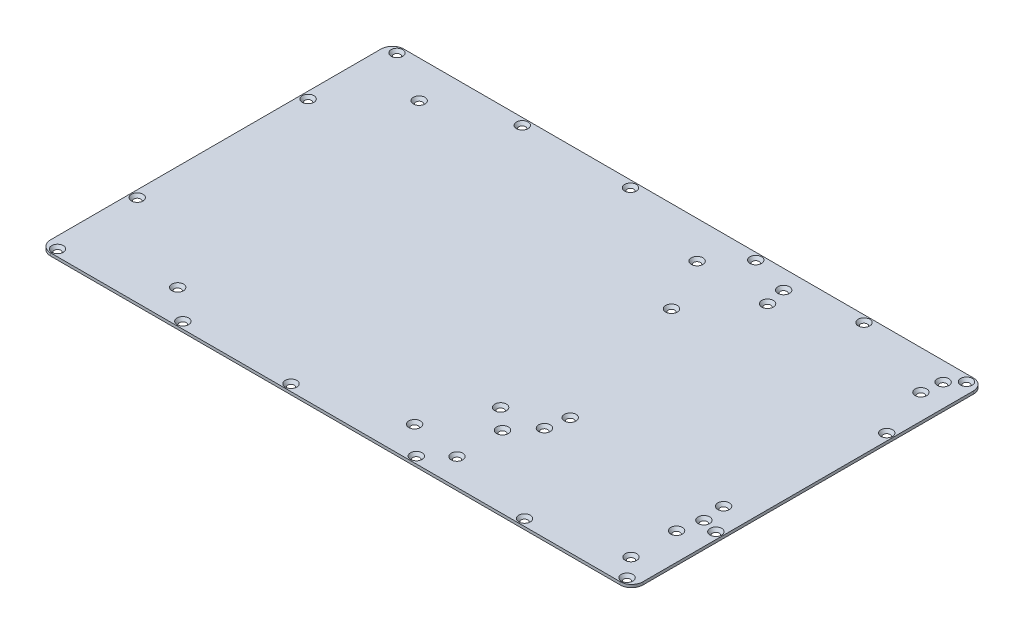
from build123d import *

# Parameters (mm, degrees)
SKETCH1_W                                     = 330.2
SKETCH1_H                                     = 196.85
BOSS_EXTRUDE1_DEPTH                           = 1.5875
FILLET1_R                                     = 6.35
CSK_FOR_4_FLAT_HEAD_SOCKET_CAP_SCREW1_A_COUNT = 2
CSK_FOR_4_FLAT_HEAD_SOCKET_CAP_SCREW1_A_PITCH = 95.25
LPATTERN1_COUNT                               = 2
LPATTERN1_PITCH                               = 120.015
CSK_FOR_4_FLAT_HEAD_SOCKET_CAP_SCREW2_A_COUNT = 2
CSK_FOR_4_FLAT_HEAD_SOCKET_CAP_SCREW2_A_PITCH = 57.15
CSK_FOR_4_FLAT_HEAD_SOCKET_CAP_SCRE_2_COUNT   = 2
CSK_FOR_4_FLAT_HEAD_SOCKET_CAP_SCRE_2_PITCH   = 117.475
CSK_FOR_4_FLAT_HEAD_SOCKET_CAP_SCRE_3_COUNT   = 2
CSK_FOR_4_FLAT_HEAD_SOCKET_CAP_SCRE_3_PITCH   = 187.325
CSK_FOR_4_FLAT_HEAD_SOCKET_CAP_SCRE_4_COUNT   = 2
CSK_FOR_4_FLAT_HEAD_SOCKET_CAP_SCRE_4_PITCH   = 247.65
CSK_FOR_4_FLAT_HEAD_SOCKET_CAP_SCRE_5_COUNT   = 2
CSK_FOR_4_FLAT_HEAD_SOCKET_CAP_SCRE_5_PITCH   = 317.5
CSK_FOR_4_FLAT_HEAD_SOCKET_CAP_SCREW3_A_COUNT = 2
CSK_FOR_4_FLAT_HEAD_SOCKET_CAP_SCREW3_A_PITCH = 88.9
CSK_FOR_4_FLAT_HEAD_SOCKET_CAP_SCRE_6_COUNT   = 2
CSK_FOR_4_FLAT_HEAD_SOCKET_CAP_SCRE_6_PITCH   = 160.266754194
CSK_FOR_4_FLAT_HEAD_SOCKET_CAP_SCRE_7_COUNT   = 2
CSK_FOR_4_FLAT_HEAD_SOCKET_CAP_SCRE_7_PITCH   = 133.35
CSK_FOR_4_FLAT_HEAD_SOCKET_CAP_SCREW4_A_COUNT = 2
CSK_FOR_4_FLAT_HEAD_SOCKET_CAP_SCREW4_A_PITCH = 85.4964
CSK_FOR_4_FLAT_HEAD_SOCKET_CAP_SCRE_8_COUNT   = 2
CSK_FOR_4_FLAT_HEAD_SOCKET_CAP_SCRE_8_PITCH   = 110.0074
CSK_FOR_4_FLAT_HEAD_SOCKET_CAP_SCRE_9_COUNT   = 2
CSK_FOR_4_FLAT_HEAD_SOCKET_CAP_SCRE_9_PITCH   = 139.324306809
CSK_FOR_4_FLAT_HEAD_SOCKET_CAP_SCREW5_A_COUNT = 2
CSK_FOR_4_FLAT_HEAD_SOCKET_CAP_SCREW5_A_PITCH = 25.4
CSK_FOR_4_FLAT_HEAD_SOCKET_CAP_SCRE_10_COUNT  = 2
CSK_FOR_4_FLAT_HEAD_SOCKET_CAP_SCRE_10_PITCH  = 97.028
CSK_FOR_4_FLAT_HEAD_SOCKET_CAP_SCRE_11_COUNT  = 2
CSK_FOR_4_FLAT_HEAD_SOCKET_CAP_SCRE_11_PITCH  = 100.297521325
CSK_FOR_4_FLAT_HEAD_SOCKET_CAP_SCREW6_A_COUNT = 2
CSK_FOR_4_FLAT_HEAD_SOCKET_CAP_SCREW6_A_PITCH = 154.94
CSK_FOR_4_FLAT_HEAD_SOCKET_CAP_SCRE_12_COUNT  = 2
CSK_FOR_4_FLAT_HEAD_SOCKET_CAP_SCRE_12_PITCH  = 220.921601479
CSK_FOR_4_FLAT_HEAD_SOCKET_CAP_SCRE_13_COUNT  = 2
CSK_FOR_4_FLAT_HEAD_SOCKET_CAP_SCRE_13_PITCH  = 159.130543894


with BuildPart() as part:
    # Sketch1 → Boss-Extrude1 (new body)
    with BuildSketch(Plane(origin=(0, 0, 0), x_dir=(1, 0, 0), z_dir=(0, 1, 0))):
        Rectangle(SKETCH1_W, SKETCH1_H)
    extrude(amount=BOSS_EXTRUDE1_DEPTH)

    # Fillet1
    fillet1_edges = [part.edges().sort_by_distance(p)[0] for p in [
        (165.1, 0.79375, 98.425),
        (-165.1, 0.79375, 98.425),
        (-165.1, 0.79375, -98.425),
        (165.1, 0.79375, -98.425),
    ]]
    fillet(fillet1_edges, radius=FILLET1_R)

    # Sketch2 → CSK for #4 Flat Head Socket Cap Screw1 (revolve, cut)
    with BuildSketch(Plane(origin=(161.29, 1.5875, 47.625), x_dir=(0, 0, 1), z_dir=(1, 0, 0))):
        Polygon((0, 0), (0, 1.5875), (1.63195, 1.5875), (1.63195, 1.848124365), (3.2385, 0), align=None)
    csk_for_4_flat_head_socket_cap_screw1 = revolve(axis=Axis((161.29, 7.9375, 47.625), (0, -1, 0)), mode=Mode.SUBTRACT)

    # CSK for #4 Flat Head Socket Cap Screw1 a: CSK for #4 Flat Head Socket Cap Screw1 ×2
    with Locations(*[(0, 0, -i * CSK_FOR_4_FLAT_HEAD_SOCKET_CAP_SCREW1_A_PITCH) for i in range(1, CSK_FOR_4_FLAT_HEAD_SOCKET_CAP_SCREW1_A_COUNT)]):
        add(csk_for_4_flat_head_socket_cap_screw1, mode=Mode.SUBTRACT)

    # LPattern1: CSK for #4 Flat Head Socket Cap Screw1 ×2
    with Locations(*[(-i * LPATTERN1_PITCH, 0, 0) for i in range(1, LPATTERN1_COUNT)]):
        add(csk_for_4_flat_head_socket_cap_screw1, mode=Mode.SUBTRACT)

    # LPattern1 copy 1 sketch → LPattern1 copy 1 (revolve, cut)
    with BuildSketch(Plane(origin=(41.275, 1.5875, -47.625), x_dir=(0, 0, 1), z_dir=(1, 0, 0))):
        Polygon((0, 0), (0, 1.5875), (1.63195, 1.5875), (1.63195, 1.848124365), (3.2385, 0), align=None)
    revolve(axis=Axis((41.275, 7.9375, -47.625), (0, -1, 0)), mode=Mode.SUBTRACT)

    # Mirror1: CSK for #4 Flat Head Socket Cap Screw1 across plane
    add(csk_for_4_flat_head_socket_cap_screw1.mirror(Plane(origin=(0, 0, 0), x_dir=(0, 0, 1), z_dir=(1, 0, 0))), mode=Mode.SUBTRACT)

    # Mirror1 copy 1 sketch → Mirror1 copy 1 (revolve, cut)
    with BuildSketch(Plane(origin=(-161.29, 1.5875, -47.625), x_dir=(0, 0, 1), z_dir=(-1, 0, 0))):
        Polygon((0, 0), (0, -1.5875), (1.63195, -1.5875), (1.63195, -1.848124365), (3.2385, 0), align=None)
    revolve(axis=Axis((-161.29, 7.9375, -47.625), (0, 1, 0)), mode=Mode.SUBTRACT)

    # Sketch7 → CSK for #4 Flat Head Socket Cap Screw2 (revolve, cut)
    with BuildSketch(Plane(origin=(158.75, 1.5875, 94.615), x_dir=(0, 0, 1), z_dir=(1, 0, 0))):
        Polygon((0, 0), (0, 1.5875), (1.63195, 1.5875), (1.63195, 1.848124365), (3.2385, 0), align=None)
    csk_for_4_flat_head_socket_cap_screw2 = revolve(axis=Axis((158.75, 7.9375, 94.615), (0, -1, 0)), mode=Mode.SUBTRACT)

    # CSK for #4 Flat Head Socket Cap Screw2 a: CSK for #4 Flat Head Socket Cap Screw2 ×2
    with Locations(*[(-i * CSK_FOR_4_FLAT_HEAD_SOCKET_CAP_SCREW2_A_PITCH, 0, 0) for i in range(1, CSK_FOR_4_FLAT_HEAD_SOCKET_CAP_SCREW2_A_COUNT)]):
        add(csk_for_4_flat_head_socket_cap_screw2, mode=Mode.SUBTRACT)

    # CSK for _4 Flat Head Socket Cap Scre 2: CSK for #4 Flat Head Socket Cap Screw2 ×2
    with Locations(*[(-i * CSK_FOR_4_FLAT_HEAD_SOCKET_CAP_SCRE_2_PITCH, 0, 0) for i in range(1, CSK_FOR_4_FLAT_HEAD_SOCKET_CAP_SCRE_2_COUNT)]):
        add(csk_for_4_flat_head_socket_cap_screw2, mode=Mode.SUBTRACT)

    # CSK for _4 Flat Head Socket Cap Scre 3: CSK for #4 Flat Head Socket Cap Screw2 ×2
    with Locations(*[(-i * CSK_FOR_4_FLAT_HEAD_SOCKET_CAP_SCRE_3_PITCH, 0, 0) for i in range(1, CSK_FOR_4_FLAT_HEAD_SOCKET_CAP_SCRE_3_COUNT)]):
        add(csk_for_4_flat_head_socket_cap_screw2, mode=Mode.SUBTRACT)

    # CSK for _4 Flat Head Socket Cap Scre 4: CSK for #4 Flat Head Socket Cap Screw2 ×2
    with Locations(*[(-i * CSK_FOR_4_FLAT_HEAD_SOCKET_CAP_SCRE_4_PITCH, 0, 0) for i in range(1, CSK_FOR_4_FLAT_HEAD_SOCKET_CAP_SCRE_4_COUNT)]):
        add(csk_for_4_flat_head_socket_cap_screw2, mode=Mode.SUBTRACT)

    # CSK for _4 Flat Head Socket Cap Scre 5: CSK for #4 Flat Head Socket Cap Screw2 ×2
    with Locations(*[(-i * CSK_FOR_4_FLAT_HEAD_SOCKET_CAP_SCRE_5_PITCH, 0, 0) for i in range(1, CSK_FOR_4_FLAT_HEAD_SOCKET_CAP_SCRE_5_COUNT)]):
        add(csk_for_4_flat_head_socket_cap_screw2, mode=Mode.SUBTRACT)

    # Mirror2: CSK for #4 Flat Head Socket Cap Screw2 across plane
    add(csk_for_4_flat_head_socket_cap_screw2.mirror(Plane.XY), mode=Mode.SUBTRACT)

    # Mirror2 copy 1 sketch → Mirror2 copy 1 (revolve, cut)
    with BuildSketch(Plane(origin=(101.6, 1.5875, -94.615), x_dir=(0, 0, -1), z_dir=(1, 0, 0))):
        Polygon((0, 0), (0, -1.5875), (1.63195, -1.5875), (1.63195, -1.848124365), (3.2385, 0), align=None)
    revolve(axis=Axis((101.6, 7.9375, -94.615), (0, 1, 0)), mode=Mode.SUBTRACT)

    # Mirror2 copy 2 sketch → Mirror2 copy 2 (revolve, cut)
    with BuildSketch(Plane(origin=(41.275, 1.5875, -94.615), x_dir=(0, 0, -1), z_dir=(1, 0, 0))):
        Polygon((0, 0), (0, -1.5875), (1.63195, -1.5875), (1.63195, -1.848124365), (3.2385, 0), align=None)
    revolve(axis=Axis((41.275, 7.9375, -94.615), (0, 1, 0)), mode=Mode.SUBTRACT)

    # Mirror2 copy 3 sketch → Mirror2 copy 3 (revolve, cut)
    with BuildSketch(Plane(origin=(-28.575, 1.5875, -94.615), x_dir=(0, 0, -1), z_dir=(1, 0, 0))):
        Polygon((0, 0), (0, -1.5875), (1.63195, -1.5875), (1.63195, -1.848124365), (3.2385, 0), align=None)
    revolve(axis=Axis((-28.575, 7.9375, -94.615), (0, 1, 0)), mode=Mode.SUBTRACT)

    # Mirror2 copy 4 sketch → Mirror2 copy 4 (revolve, cut)
    with BuildSketch(Plane(origin=(-88.9, 1.5875, -94.615), x_dir=(0, 0, -1), z_dir=(1, 0, 0))):
        Polygon((0, 0), (0, -1.5875), (1.63195, -1.5875), (1.63195, -1.848124365), (3.2385, 0), align=None)
    revolve(axis=Axis((-88.9, 7.9375, -94.615), (0, 1, 0)), mode=Mode.SUBTRACT)

    # Mirror2 copy 5 sketch → Mirror2 copy 5 (revolve, cut)
    with BuildSketch(Plane(origin=(-158.75, 1.5875, -94.615), x_dir=(0, 0, -1), z_dir=(1, 0, 0))):
        Polygon((0, 0), (0, -1.5875), (1.63195, -1.5875), (1.63195, -1.848124365), (3.2385, 0), align=None)
    revolve(axis=Axis((-158.75, 7.9375, -94.615), (0, 1, 0)), mode=Mode.SUBTRACT)

    # Sketch9 → CSK for #4 Flat Head Socket Cap Screw3 (revolve, cut)
    with BuildSketch(Plane(origin=(152.4, 1.5875, -87.9348), x_dir=(0, 0, 1), z_dir=(1, 0, 0))):
        Polygon((0, 0), (0, 1.5875), (1.63195, 1.5875), (1.63195, 1.848124365), (3.2385, 0), align=None)
    csk_for_4_flat_head_socket_cap_screw3 = revolve(axis=Axis((152.4, 7.9375, -87.9348), (0, -1, 0)), mode=Mode.SUBTRACT)

    # CSK for #4 Flat Head Socket Cap Screw3 a: CSK for #4 Flat Head Socket Cap Screw3 ×2
    with Locations(*[(-i * CSK_FOR_4_FLAT_HEAD_SOCKET_CAP_SCREW3_A_PITCH, 0, 0) for i in range(1, CSK_FOR_4_FLAT_HEAD_SOCKET_CAP_SCREW3_A_COUNT)]):
        add(csk_for_4_flat_head_socket_cap_screw3, mode=Mode.SUBTRACT)

    # CSK for _4 Flat Head Socket Cap Scre 6: CSK for #4 Flat Head Socket Cap Screw3 ×2
    with Locations(*[Vector(-0.5547001962252291, 0, 0.8320502943378437) * (i * CSK_FOR_4_FLAT_HEAD_SOCKET_CAP_SCRE_6_PITCH) for i in range(1, CSK_FOR_4_FLAT_HEAD_SOCKET_CAP_SCRE_6_COUNT)]):
        add(csk_for_4_flat_head_socket_cap_screw3, mode=Mode.SUBTRACT)

    # CSK for _4 Flat Head Socket Cap Scre 7: CSK for #4 Flat Head Socket Cap Screw3 ×2
    with Locations(*[(0, 0, i * CSK_FOR_4_FLAT_HEAD_SOCKET_CAP_SCRE_7_PITCH) for i in range(1, CSK_FOR_4_FLAT_HEAD_SOCKET_CAP_SCRE_7_COUNT)]):
        add(csk_for_4_flat_head_socket_cap_screw3, mode=Mode.SUBTRACT)

    # Sketch11 → CSK for #4 Flat Head Socket Cap Screw4 (revolve, cut)
    with BuildSketch(Plane(origin=(65.6336, 1.5875, -76.835), x_dir=(0, 0, 1), z_dir=(1, 0, 0))):
        Polygon((0, 0), (0, 1.5875), (1.63195, 1.5875), (1.63195, 1.848124365), (3.2385, 0), align=None)
    csk_for_4_flat_head_socket_cap_screw4 = revolve(axis=Axis((65.6336, 7.9375, -76.835), (0, -1, 0)), mode=Mode.SUBTRACT)

    # CSK for #4 Flat Head Socket Cap Screw4 a: CSK for #4 Flat Head Socket Cap Screw4 ×2
    with Locations(*[(i * CSK_FOR_4_FLAT_HEAD_SOCKET_CAP_SCREW4_A_PITCH, 0, 0) for i in range(1, CSK_FOR_4_FLAT_HEAD_SOCKET_CAP_SCREW4_A_COUNT)]):
        add(csk_for_4_flat_head_socket_cap_screw4, mode=Mode.SUBTRACT)

    # CSK for _4 Flat Head Socket Cap Scre 8: CSK for #4 Flat Head Socket Cap Screw4 ×2
    with Locations(*[(0, 0, i * CSK_FOR_4_FLAT_HEAD_SOCKET_CAP_SCRE_8_PITCH) for i in range(1, CSK_FOR_4_FLAT_HEAD_SOCKET_CAP_SCRE_8_COUNT)]):
        add(csk_for_4_flat_head_socket_cap_screw4, mode=Mode.SUBTRACT)

    # CSK for _4 Flat Head Socket Cap Scre 9: CSK for #4 Flat Head Socket Cap Screw4 ×2
    with Locations(*[Vector(0.6136502808329188, 0, 0.7895779460152619) * (i * CSK_FOR_4_FLAT_HEAD_SOCKET_CAP_SCRE_9_PITCH) for i in range(1, CSK_FOR_4_FLAT_HEAD_SOCKET_CAP_SCRE_9_COUNT)]):
        add(csk_for_4_flat_head_socket_cap_screw4, mode=Mode.SUBTRACT)

    # Sketch13 → CSK for #4 Flat Head Socket Cap Screw5 (revolve, cut)
    with BuildSketch(Plane(origin=(149.86, 1.5875, 58.1152), x_dir=(0, 0, 1), z_dir=(1, 0, 0))):
        Polygon((0, 0), (0, 1.5875), (1.63195, 1.5875), (1.63195, 1.848124365), (3.2385, 0), align=None)
    csk_for_4_flat_head_socket_cap_screw5 = revolve(axis=Axis((149.86, 7.9375, 58.1152), (0, -1, 0)), mode=Mode.SUBTRACT)

    # CSK for #4 Flat Head Socket Cap Screw5 a: CSK for #4 Flat Head Socket Cap Screw5 ×2
    with Locations(*[(0, 0, i * CSK_FOR_4_FLAT_HEAD_SOCKET_CAP_SCREW5_A_PITCH) for i in range(1, CSK_FOR_4_FLAT_HEAD_SOCKET_CAP_SCREW5_A_COUNT)]):
        add(csk_for_4_flat_head_socket_cap_screw5, mode=Mode.SUBTRACT)

    # CSK for _4 Flat Head Socket Cap Scre 10: CSK for #4 Flat Head Socket Cap Screw5 ×2
    with Locations(*[(-i * CSK_FOR_4_FLAT_HEAD_SOCKET_CAP_SCRE_10_PITCH, 0, 0) for i in range(1, CSK_FOR_4_FLAT_HEAD_SOCKET_CAP_SCRE_10_COUNT)]):
        add(csk_for_4_flat_head_socket_cap_screw5, mode=Mode.SUBTRACT)

    # CSK for _4 Flat Head Socket Cap Scre 11: CSK for #4 Flat Head Socket Cap Screw5 ×2
    with Locations(*[Vector(-0.9674017734226894, 0, 0.25324653754520676) * (i * CSK_FOR_4_FLAT_HEAD_SOCKET_CAP_SCRE_11_PITCH) for i in range(1, CSK_FOR_4_FLAT_HEAD_SOCKET_CAP_SCRE_11_COUNT)]):
        add(csk_for_4_flat_head_socket_cap_screw5, mode=Mode.SUBTRACT)

    # Sketch15 → CSK for #4 Flat Head Socket Cap Screw6 (revolve, cut)
    with BuildSketch(Plane(origin=(-129.54, 1.5875, -77.7748), x_dir=(0, 0, 1), z_dir=(1, 0, 0))):
        Polygon((0, 0), (0, 1.5875), (1.63195, 1.5875), (1.63195, 1.848124365), (3.2385, 0), align=None)
    csk_for_4_flat_head_socket_cap_screw6 = revolve(axis=Axis((-129.54, 7.9375, -77.7748), (0, -1, 0)), mode=Mode.SUBTRACT)

    # CSK for #4 Flat Head Socket Cap Screw6 a: CSK for #4 Flat Head Socket Cap Screw6 ×2
    with Locations(*[(i * CSK_FOR_4_FLAT_HEAD_SOCKET_CAP_SCREW6_A_PITCH, 0, 0) for i in range(1, CSK_FOR_4_FLAT_HEAD_SOCKET_CAP_SCREW6_A_COUNT)]):
        add(csk_for_4_flat_head_socket_cap_screw6, mode=Mode.SUBTRACT)

    # CSK for _4 Flat Head Socket Cap Scre 12: CSK for #4 Flat Head Socket Cap Screw6 ×2
    with Locations(*[Vector(0.7013347674595831, 0, 0.7128320587294124) * (i * CSK_FOR_4_FLAT_HEAD_SOCKET_CAP_SCRE_12_PITCH) for i in range(1, CSK_FOR_4_FLAT_HEAD_SOCKET_CAP_SCRE_12_COUNT)]):
        add(csk_for_4_flat_head_socket_cap_screw6, mode=Mode.SUBTRACT)

    # CSK for _4 Flat Head Socket Cap Scre 13: CSK for #4 Flat Head Socket Cap Screw6 ×2
    with Locations(*[Vector(0.14365563920417196, 0, 0.9896277367398515) * (i * CSK_FOR_4_FLAT_HEAD_SOCKET_CAP_SCRE_13_PITCH) for i in range(1, CSK_FOR_4_FLAT_HEAD_SOCKET_CAP_SCRE_13_COUNT)]):
        add(csk_for_4_flat_head_socket_cap_screw6, mode=Mode.SUBTRACT)


solid = part.part
